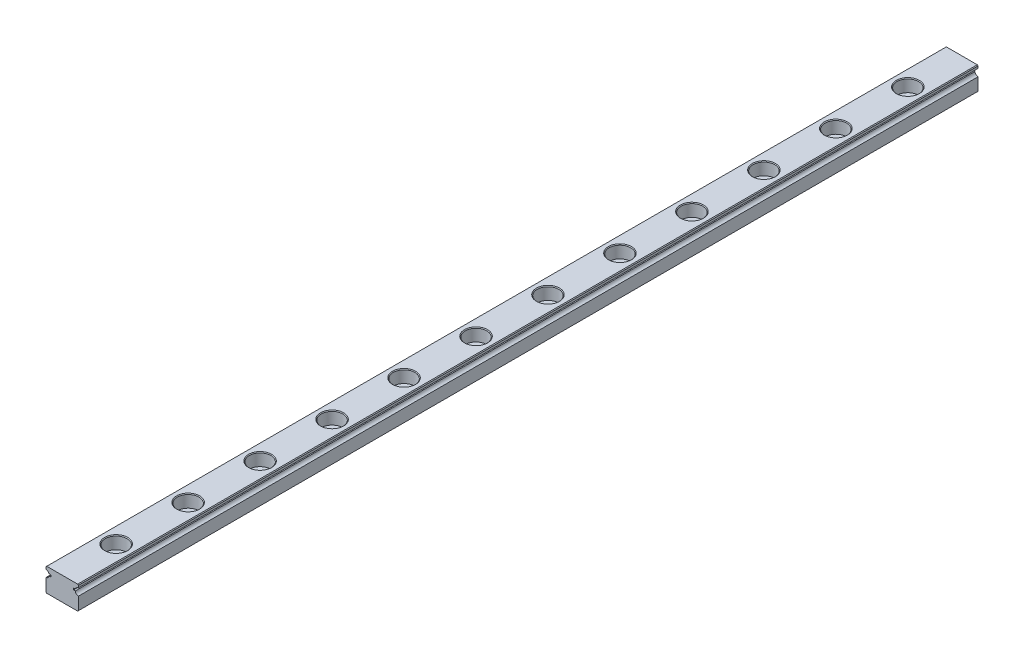
from build123d import *

# Parameters (mm, degrees)
EXTRUDE1_DEPTH             = 250
EXTRUDE2_REACH             = 252.125
SKETCH2_R                  = 1.75
SKETCH_R                   = 3
SKETCH_R_2                 = 1.75
EXTRUDE4_DEPTH             = 3.5
CHAMFER1_SIZE              = 0.2
LPATTERN1_COUNT            = 12
LPATTERN1_PITCH            = 20
CHAMFER1_OF_LPATTERN1_SIZE = 0.2


with BuildPart() as part:
    # Sketch1 → Extrude1 (new body)
    with BuildSketch(Plane.XY):
        with BuildLine():
            Line((-4.3, -3.25), (4.3, -3.25))
            Line((4.3, -3.25), (4.5, -3.05))
            Line((4.5, -3.05), (4.5, 0.455012563))
            ThreePointArc((4.5, 0.455012563), (3.924845827, 0.712323349), (3.617735397, 1.2625))
            Line((3.617735397, 1.2625), (3.15008224, 1.2625))
            Line((3.15008224, 1.2625), (3.15008224, 1.7625))
            Line((3.15008224, 1.7625), (3.65008224, 1.7625))
            ThreePointArc((3.65008224, 1.7625), (3.973877727, 2.229724887), (4.5, 2.444987437))
            Line((4.5, 2.444987437), (4.5, 3.05))
            Line((4.5, 3.05), (4.3, 3.25))
            Line((4.3, 3.25), (-4.3, 3.25))
            Line((-4.3, 3.25), (-4.5, 3.05))
            Line((-4.5, 3.05), (-4.5, 2.444987437))
            ThreePointArc((-4.5, 2.444987437), (-3.973877727, 2.229724887), (-3.65008224, 1.7625))
            Line((-3.65008224, 1.7625), (-3.15008224, 1.7625))
            Line((-3.15008224, 1.7625), (-3.15008224, 1.2625))
            Line((-3.15008224, 1.2625), (-3.617735397, 1.2625))
            ThreePointArc((-3.617735397, 1.2625), (-3.924845827, 0.712323349), (-4.5, 0.455012563))
            Line((-4.5, 0.455012563), (-4.5, -3.05))
            Line((-4.5, -3.05), (-4.3, -3.25))
        make_face()
    extrude(amount=EXTRUDE1_DEPTH)

    # Sketch2 → Extrude2 (cut, up to next)
    with BuildSketch(Plane(origin=(0, 3.25, 0), x_dir=(1, 0, 0), z_dir=(0, 1, 0)), mode=Mode.PRIVATE) as extrude2_sk1:
        with Locations(Location((0, -15, 0), (0, 0, 270))):
            Circle(SKETCH2_R)
    extrude2_tool1 = extrude(extrude2_sk1.sketch, amount=-EXTRUDE2_REACH, mode=Mode.PRIVATE) & part.part
    extrude2 = extrude2_tool1.solids().sort_by_distance((0, 3.25, 15))[0]
    add(extrude2, mode=Mode.SUBTRACT)

    # Sketch → Extrude4 (cut)
    with BuildSketch(Plane(origin=(0, 3.25, 0), x_dir=(1, 0, 0), z_dir=(0, 1, 0))):
        with Locations(Location((0, -15, 0), (0, 0, 270))):
            Circle(SKETCH_R)
        with Locations(Location((0, -15, 0), (0, 0, 270))):
            Circle(SKETCH_R_2, mode=Mode.SUBTRACT)
    extrude4 = extrude(amount=-EXTRUDE4_DEPTH, mode=Mode.SUBTRACT)

    # Chamfer1
    chamfer1_edges = [part.edges().sort_by_distance(p)[0] for p in [
        (0, -3.25, 13.25),
        (0, 3.25, 12),
    ]]
    chamfer(chamfer1_edges, length=CHAMFER1_SIZE)

    # LPattern1: Extrude2, Extrude4 ×12
    with Locations(*[(0, 0, i * LPATTERN1_PITCH) for i in range(1, LPATTERN1_COUNT)]):
        add(extrude2, mode=Mode.SUBTRACT)
        add(extrude4, mode=Mode.SUBTRACT)

    # Chamfer1 of LPattern1
    chamfer1_of_lpattern1_edges = [part.edges().sort_by_distance(p)[0] for p in [
        (0, -3.25, 33.25),
        (0, 3.25, 32),
        (0, -3.25, 53.25),
        (0, 3.25, 52),
        (0, -3.25, 73.25),
        (0, 3.25, 72),
        (0, -3.25, 93.25),
        (0, 3.25, 92),
        (0, -3.25, 113.25),
        (0, 3.25, 112),
        (0, -3.25, 133.25),
        (0, 3.25, 132),
        (0, -3.25, 153.25),
        (0, 3.25, 152),
        (0, -3.25, 173.25),
        (0, 3.25, 172),
        (0, -3.25, 193.25),
        (0, 3.25, 192),
        (0, -3.25, 213.25),
        (0, 3.25, 212),
        (0, -3.25, 233.25),
        (0, 3.25, 232),
    ]]
    chamfer(chamfer1_of_lpattern1_edges, length=CHAMFER1_OF_LPATTERN1_SIZE)


solid = part.part
